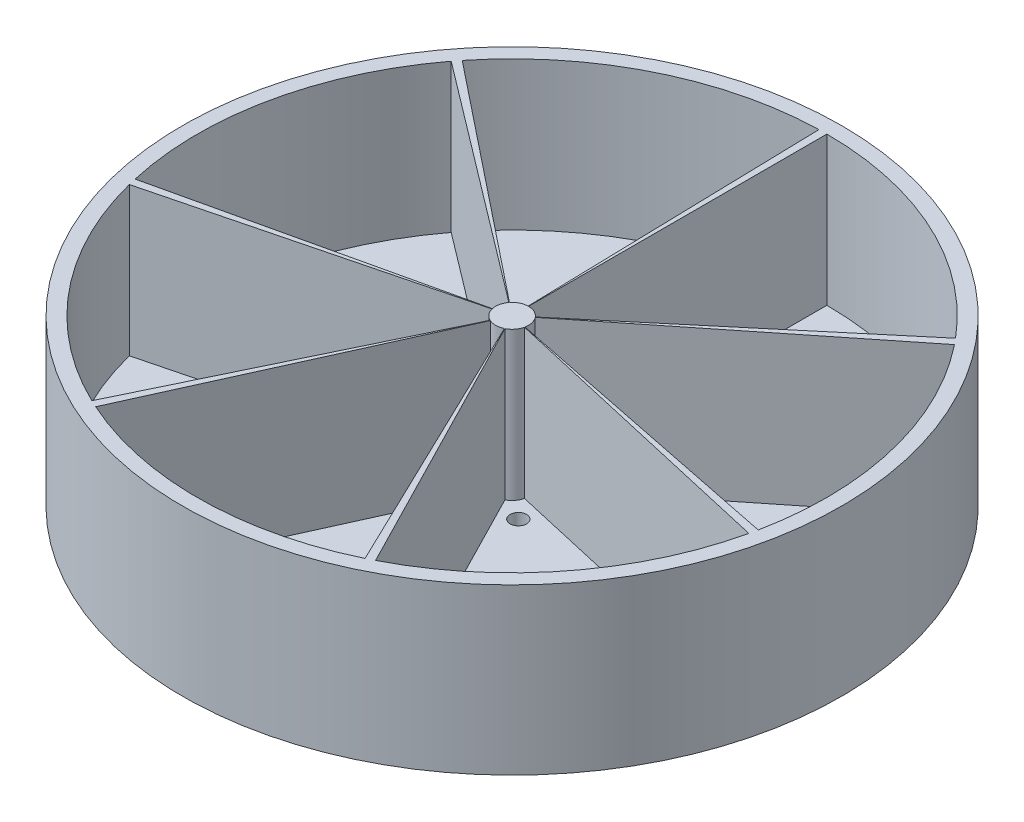
from build123d import *

# Parameters (mm, degrees)
SKETCH1_W          = 100
SKETCH1_H          = 50
CUT_EXTRUDE4_DEPTH = 45
SKETCH3_R          = 2.5
CUT_EXTRUDE5_DEPTH = 10


with BuildPart() as part:
    # Sketch1 → Revolve1 (revolve)
    with BuildSketch(Plane.XY, mode=Mode.PRIVATE) as revolve1_sk:
        with Locations((50, 25)):
            Rectangle(SKETCH1_W, SKETCH1_H)
    revolve(revolve1_sk.sketch.rotate(Axis((0, 0, 0), (0, 1, 0)), 90), axis=Axis((0, 0, 0), (0, 1, 0)))

    # Sketch2 → Cut-Extrude4 (cut)
    with BuildSketch(Plane(origin=(0, 50, 0), x_dir=(1, 0, 0), z_dir=(0, 1, 0))):
        with BuildLine():
            Line((0, 5), (0, 95.51671112))
            ThreePointArc((0, 95.51671112), (40.367106421, 86.56753908), (73.170045778, 61.396958426))
            Line((73.170045778, 61.396958426), (3.830222216, 3.213938048))
            ThreePointArc((3.830222216, 3.213938048), (2.113091309, 4.531538935), (0, 5))
        make_face()
        with BuildLine():
            Line((3.909157412, 3.117449009), (74.677971855, 59.55369529))
            ThreePointArc((74.677971855, 59.55369529), (92.849706596, 22.413703133), (93.62285237, -18.92626792))
            Line((93.62285237, -18.92626792), (4.900862439, -0.990730716))
            ThreePointArc((4.900862439, -0.990730716), (4.860390685, 1.173287002), (3.909157412, 3.117449009))
        make_face()
        with BuildLine():
            Line((4.874639561, -1.11260467), (93.121907751, -21.254467767))
            ThreePointArc((93.121907751, -21.254467767), (75.414583916, -58.61810843), (43.575741568, -84.997628496))
            Line((43.575741568, -84.997628496), (2.281053287, -4.449359044))
            ThreePointArc((2.281053287, -4.449359044), (3.947716742, -3.068473974), (4.874639561, -1.11260467))
        make_face()
        with BuildLine():
            Line((2.169418696, -4.50484434), (41.443147769, -86.057583084))
            ThreePointArc((41.443147769, -86.057583084), (1.19074137, -95.509288753), (-39.284791417, -87.064041179))
            Line((-39.284791417, -87.064041179), (-2.056435516, -4.557529262))
            ThreePointArc((-2.056435516, -4.557529262), (0.062331573, -4.999611462), (2.169418696, -4.50484434))
        make_face()
        with BuildLine():
            Line((-2.169418696, -4.50484434), (-41.443147769, -86.057583084))
            ThreePointArc((-41.443147769, -86.057583084), (-73.929753715, -60.480026611), (-92.563075202, -23.569455072))
            Line((-92.563075202, -23.569455072), (-4.845386431, -1.233786988))
            ThreePointArc((-4.845386431, -1.233786988), (-3.869990541, -3.165939546), (-2.169418696, -4.50484434))
        make_face()
        with BuildLine():
            Line((-4.874639561, -1.11260467), (-93.121907751, -21.254467767))
            ThreePointArc((-93.121907751, -21.254467767), (-93.37963636, 20.091929137), (-76.139475417, 57.673411434))
            Line((-76.139475417, 57.673411434), (-3.985662536, 3.019022052))
            ThreePointArc((-3.985662536, 3.019022052), (-4.888130845, 1.051749422), (-4.874639561, -1.11260467))
        make_face()
        with BuildLine():
            Line((-3.909157412, 3.117449009), (-74.677971855, 59.55369529))
            ThreePointArc((-74.677971855, 59.55369529), (-42.512748229, 85.534252444), (-2.381297681, 95.487022807))
            Line((-2.381297681, 95.487022807), (-0.124653459, 4.99844591))
            ThreePointArc((-0.124653459, 4.99844591), (-2.225408922, 4.477449623), (-3.909157412, 3.117449009))
        make_face()
    extrude(amount=-CUT_EXTRUDE4_DEPTH, mode=Mode.SUBTRACT)

    # Sketch3 → Cut-Extrude5 (cut)
    with BuildSketch(Plane.XZ):
        with Locations(Location((0, 11, 0), (0, 0, 270))):
            Circle(SKETCH3_R)
        with Locations(Location((9.38197779, 7.481877622, 0), (0, 0, 270))):
            Circle(SKETCH3_R)
        with Locations(Location((12.480966429, -2.046761406, 0), (0, 0, 270))):
            Circle(SKETCH3_R)
        with Locations(Location((6.963364264, -10.410657547, 0), (0, 0, 270))):
            Circle(SKETCH3_R)
        with Locations(Location((-3.015961736, -11.311626415, 0), (0, 0, 270))):
            Circle(SKETCH3_R)
        with Locations(Location((-9.942375552, -4.071220075, 0), (0, 0, 270))):
            Circle(SKETCH3_R)
        with Locations(Location((-8.600146307, 5.85838782, 0), (0, 0, 270))):
            Circle(SKETCH3_R)
    extrude(amount=-CUT_EXTRUDE5_DEPTH, mode=Mode.SUBTRACT)


solid = part.part
